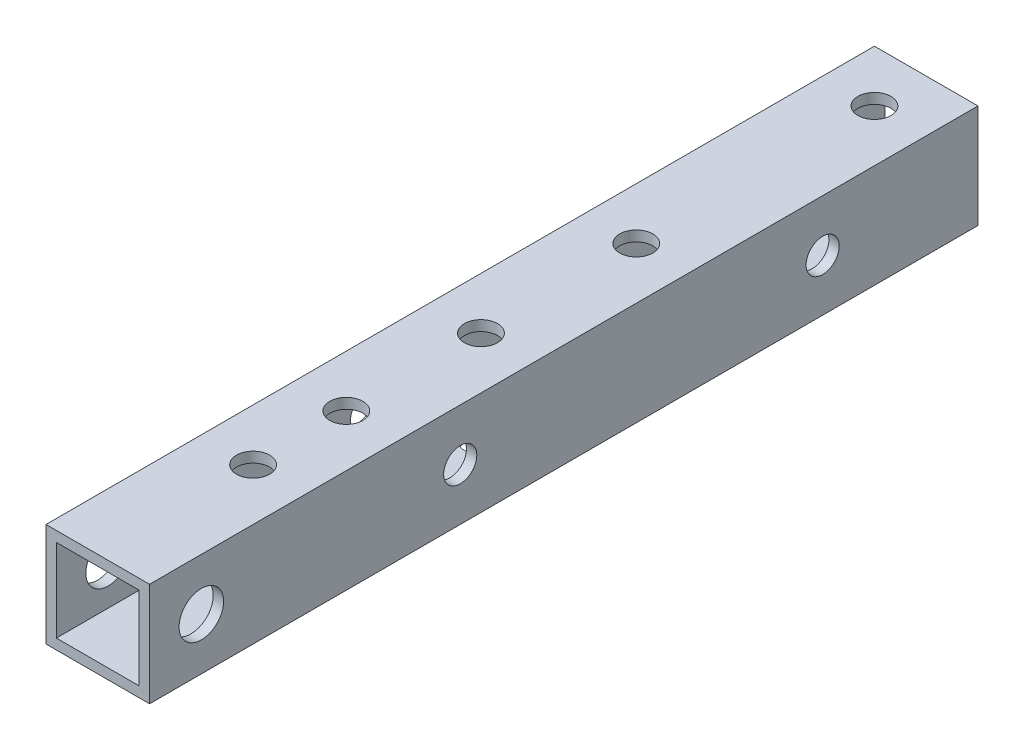
from build123d import *

# Parameters (mm, degrees)
SKETCH_1_W          = 10
SKETCH_1_H          = 10
SKETCH_1_W_2        = 8
SKETCH_1_H_2        = 8
EXTRUDE_1_DEPTH     = 80
SKETCH_2_R          = 1.6
CUT_EXTRUDE_1_DEPTH = 81.777472107
SKETCH_3_R          = 1.6
CUT_EXTRUDE_2_DEPTH = 81.777472107
SKETCH_4_R          = 1.6
CUT_EXTRUDE_3_DEPTH = 81.777472107
SKETCH_5_R          = 1.6
CUT_EXTRUDE_4_DEPTH = 81.777472107
SKETCH_6_R          = 1.6
CUT_EXTRUDE_5_DEPTH = 81.777472107
SKETCH_7_R          = 2.15
CUT_EXTRUDE_6_DEPTH = 81.777472107


with BuildPart() as part:
    # ｽｹｯﾁ1 → 押し出し-薄板1 (new body)
    with BuildSketch(Plane.XY):
        Rectangle(SKETCH_1_W, SKETCH_1_H)
        Rectangle(SKETCH_1_W_2, SKETCH_1_H_2, mode=Mode.SUBTRACT)
    extrude(amount=EXTRUDE_1_DEPTH)

    # ｽｹｯﾁ2 → ｶｯﾄ - 押し出し1 (cut, through all)
    with BuildSketch(Plane(origin=(0, 5, 0), x_dir=(1, 0, 0), z_dir=(0, 1, 0))):
        with Locations(Location((0, -5, 0), (0, 0, 180))):
            Circle(SKETCH_2_R)
    extrude(amount=-CUT_EXTRUDE_1_DEPTH, mode=Mode.SUBTRACT)

    # ｽｹｯﾁ3 → ｶｯﾄ - 押し出し2 (cut, through all)
    with BuildSketch(Plane(origin=(5, 0, 0), x_dir=(0, 0, -1), z_dir=(1, 0, 0))):
        with Locations(Location((-15, 0, 0), (0, 0, 90))):
            Circle(SKETCH_3_R)
    extrude(amount=-CUT_EXTRUDE_2_DEPTH, mode=Mode.SUBTRACT)

    # ｽｹｯﾁ4 → ｶｯﾄ - 押し出し3 (cut, through all)
    with BuildSketch(Plane.XZ.offset(5)):
        with Locations((0, 65)):
            Circle(SKETCH_4_R)
        with Locations((0, 56)):
            Circle(SKETCH_4_R)
    extrude(amount=-CUT_EXTRUDE_3_DEPTH, mode=Mode.SUBTRACT)

    # ｽｹｯﾁ5 → ｶｯﾄ - 押し出し4 (cut, through all)
    with BuildSketch(Plane.ZY.offset(5)):
        with Locations(Location((50, 0, 0), (0, 0, 270))):
            Circle(SKETCH_5_R)
    extrude(amount=-CUT_EXTRUDE_4_DEPTH, mode=Mode.SUBTRACT)

    # ｽｹｯﾁ6 → ｶｯﾄ - 押し出し5 (cut, through all)
    with BuildSketch(Plane(origin=(0, 5, 0), x_dir=(1, 0, 0), z_dir=(0, 1, 0))):
        with Locations(Location((0, -43, 0), (0, 0, 180))):
            Circle(SKETCH_6_R)
        with Locations(Location((0, -28, 0), (0, 0, 180))):
            Circle(SKETCH_6_R)
    extrude(amount=-CUT_EXTRUDE_5_DEPTH, mode=Mode.SUBTRACT)

    # ｽｹｯﾁ7 → ｶｯﾄ - 押し出し6 (cut, through all)
    with BuildSketch(Plane(origin=(5, 0, 0), x_dir=(0, 0, -1), z_dir=(1, 0, 0))):
        with Locations(Location((-75, 0, 0), (0, 0, 90))):
            Circle(SKETCH_7_R)
    extrude(amount=-CUT_EXTRUDE_6_DEPTH, mode=Mode.SUBTRACT)


solid = part.part
